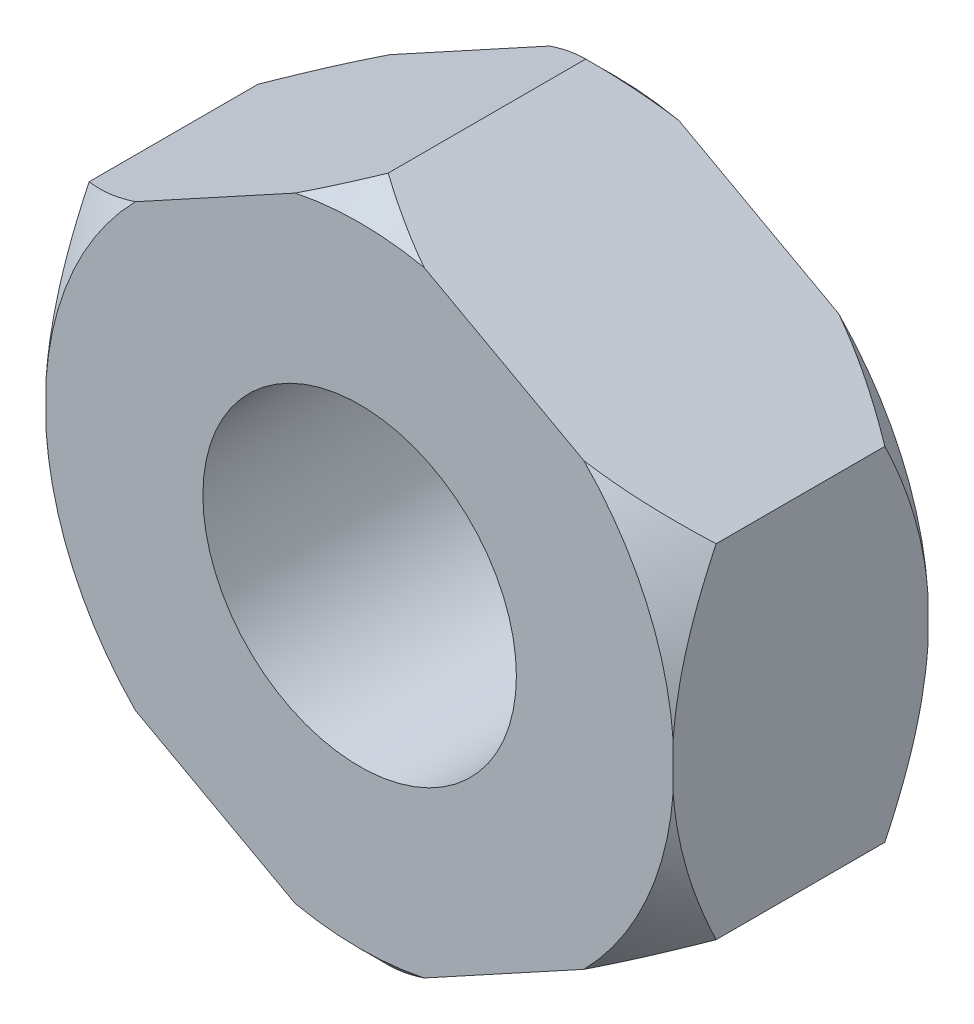
from build123d import *

# Parameters (mm, degrees)
SKETCH1_R = 0.8
NUT_DEPTH = 1.3


with BuildPart() as part:
    # Sketch1 → NUT (new body)
    with BuildSketch(Plane.XY):
        Polygon((-1.6, -0.875), (-1.6, 0.875), (0, 1.75), (1.6, 0.875), (1.6, -0.875), (0, -1.75), align=None)
        Circle(SKETCH1_R, mode=Mode.SUBTRACT)
    extrude(amount=NUT_DEPTH)

    # Sketch2 → Cut-Revolve1 (revolve, cut)
    with BuildSketch(Plane(origin=(0, 0, 0), x_dir=(0, 0, -1), z_dir=(1, 0, 0))):
        Polygon((-1.3, 1.604166667), (-0.666550175, 2.237616491), (-1.3, 2.237616491), (-1.3, 1.75), align=None)
        Polygon((0, 2.237616491), (-0.633449825, 2.237616491), (0, 1.604166667), (0, 1.75), align=None)
    revolve(axis=Axis((0, 0, 1.3), (0, 0, -1)), mode=Mode.SUBTRACT)


solid = part.part
